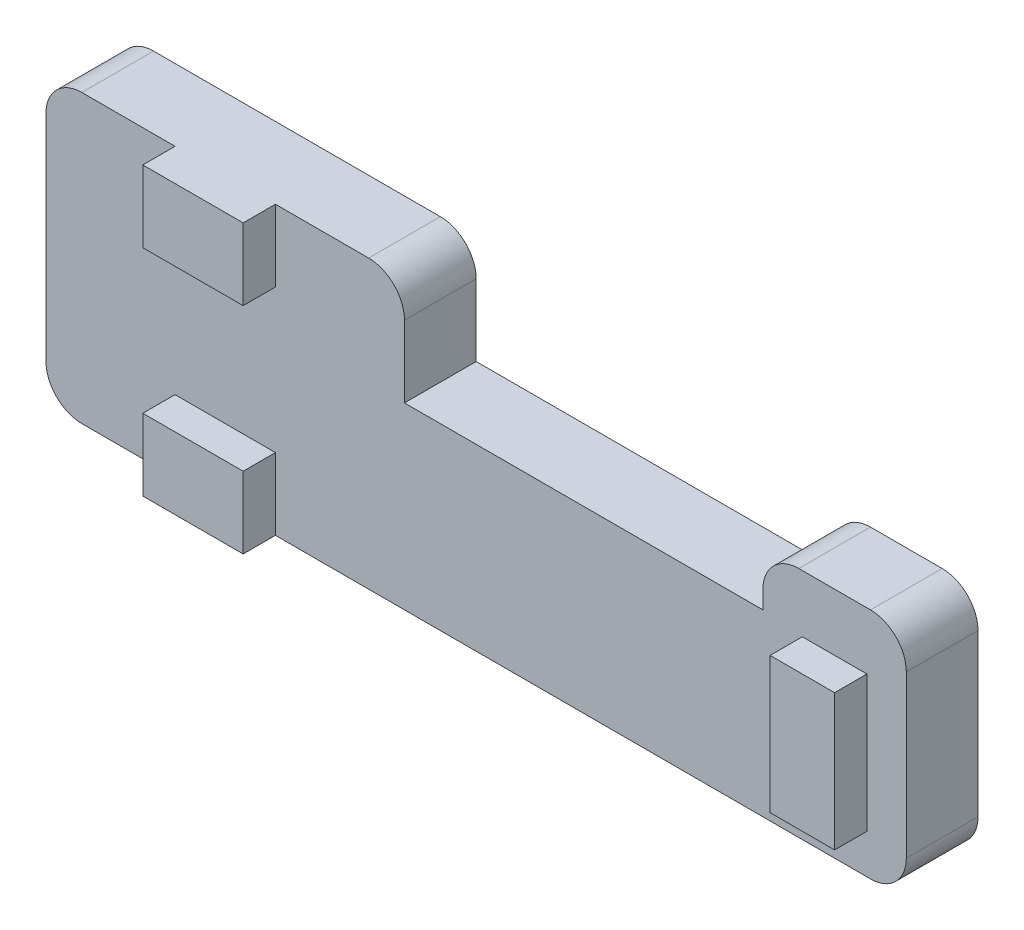
from build123d import *

# Parameters (mm, degrees)
SKETCH1_W           = 14
SKETCH1_H           = 22
SKETCH1_W_2         = 10
SKETCH1_H_2         = 18
EXTRUDE_THIN1_DEPTH = 2
SKETCH2_W           = 2
SKETCH2_H           = 22
BOSS_EXTRUDE1_DEPTH = 4.5
SKETCH3_W           = 22
SKETCH3_H           = 8
SKETCH3_W_2         = 18
SKETCH3_H_2         = 4
EXTRUDE_THIN2_DEPTH = 2
SKETCH4_W           = 20
SKETCH4_H           = 8
CUT_EXTRUDE1_DEPTH  = 26
SKETCH5_W           = 0.9
SKETCH5_H           = 1.9
SKETCH5_H_2         = 3.8
BOSS_EXTRUDE2_DEPTH = 0.9
SKETCH6_W           = 2
SKETCH6_H           = 1.9
BOSS_EXTRUDE3_DEPTH = 8
SKETCH7_W           = 2.8
SKETCH7_H           = 2
BOSS_EXTRUDE4_DEPTH = 0.9
SKETCH8_W           = 0.9
SKETCH8_H           = 0.9
CUT_EXTRUDE2_DEPTH  = 25.657656012
BOSS_EXTRUDE5_REACH = 26.658
SKETCH9_W           = 2
SKETCH9_H           = 3
BOSS_EXTRUDE6_DEPTH = 2
SKETCH11_W          = 1.1
SKETCH11_H          = 3.8
BOSS_EXTRUDE7_DEPTH = 0.9
SKETCH12_W          = 1.1
SKETCH12_H          = 3.8
CUT_EXTRUDE3_DEPTH  = 0.9
FILLET1_R           = 1


with BuildPart() as part:
    # Sketch1 → Extrude-Thin1 (new body)
    with BuildSketch(Plane(origin=(0, 0, 0), x_dir=(1, 0, 0), z_dir=(0, 1, 0))):
        with Locations((5, 9)):
            Rectangle(SKETCH1_W, SKETCH1_H)
        with Locations((5, 9)):
            Rectangle(SKETCH1_W_2, SKETCH1_H_2, mode=Mode.SUBTRACT)
    extrude(amount=EXTRUDE_THIN1_DEPTH)

    # Sketch2 → Boss-Extrude1 (add)
    with BuildSketch(Plane(origin=(0, 2, 0), x_dir=(1, 0, 0), z_dir=(0, 1, 0))):
        with Locations((11, 9)):
            Rectangle(SKETCH2_W, SKETCH2_H)
    extrude(amount=BOSS_EXTRUDE1_DEPTH)

    # Sketch3 → Extrude-Thin2 (add)
    with BuildSketch(Plane.ZY.offset(2)):
        with Locations((-9, 4)):
            Rectangle(SKETCH3_W, SKETCH3_H)
        with Locations((-9, 4)):
            Rectangle(SKETCH3_W_2, SKETCH3_H_2, mode=Mode.SUBTRACT)
    extrude(amount=-EXTRUDE_THIN2_DEPTH)

    # Sketch4 → Cut-Extrude1 (cut)
    with BuildSketch(Plane(origin=(12, 0, 0), x_dir=(0, 0, -1), z_dir=(1, 0, 0))):
        with Locations((8, 4)):
            Rectangle(SKETCH4_W, SKETCH4_H)
    extrude(amount=-CUT_EXTRUDE1_DEPTH, mode=Mode.SUBTRACT)

    # Sketch5 → Boss-Extrude2 (add)
    with BuildSketch(Plane.XY.offset(-18)):
        with Locations((-1.55, 7.05)):
            Rectangle(SKETCH5_W, SKETCH5_H)
        with Locations((-1.55, 0.95)):
            Rectangle(SKETCH5_W, SKETCH5_H)
        with Locations((11.55, 3)):
            Rectangle(SKETCH5_W, SKETCH5_H_2)
    extrude(amount=BOSS_EXTRUDE2_DEPTH)

    # Sketch6 → Boss-Extrude3 (add)
    with BuildSketch(Plane.ZY.offset(2)):
        Polygon((-18, 1.9), (-18, 6.1), (-18, 8), (-20, 8), (-20, 1.9), align=None)
        with Locations((-19, 0.95)):
            Rectangle(SKETCH6_W, SKETCH6_H)
    extrude(amount=BOSS_EXTRUDE3_DEPTH)

    # Sketch7 → Boss-Extrude4 (add)
    with BuildSketch(Plane.XY.offset(-18)):
        with Locations((-5, 7)):
            Rectangle(SKETCH7_W, SKETCH7_H)
        with Locations((-5, 1)):
            Rectangle(SKETCH7_W, SKETCH7_H)
    extrude(amount=BOSS_EXTRUDE4_DEPTH)

    # Sketch8 → Cut-Extrude2 (cut, through all)
    with BuildSketch(Plane(origin=(0, 8, 0), x_dir=(1, 0, 0), z_dir=(0, 1, 0))):
        with Locations((-1.55, 17.55)):
            Rectangle(SKETCH8_W, SKETCH8_H)
    extrude(amount=-CUT_EXTRUDE2_DEPTH, mode=Mode.SUBTRACT)

    # Sketch9 → Boss-Extrude5 (add, up to next)
    with BuildSketch(Plane(origin=(0, 0, 0), x_dir=(0, 0, -1), z_dir=(1, 0, 0)), mode=Mode.PRIVATE) as boss_extrude5_sk1:
        with Locations((19, 3.5)):
            Rectangle(SKETCH9_W, SKETCH9_H)
    boss_extrude5_tool1 = extrude(boss_extrude5_sk1.sketch, amount=BOSS_EXTRUDE5_REACH, mode=Mode.PRIVATE) - part.part
    add(boss_extrude5_tool1.solids().sort_by_distance((0, 3.5, -19))[0])

    # Sketch10 → Boss-Extrude6 (add)
    with BuildSketch(Plane(origin=(12, 0, 0), x_dir=(0, 0, -1), z_dir=(1, 0, 0))):
        Polygon((18, 6.5), (18, 4.9), (17.1, 4.9), (17.1, 1.1), (18, 1.1), (18, 0), (20, 0), (20, 6.5), align=None)
    extrude(amount=BOSS_EXTRUDE6_DEPTH)

    # Sketch11 → Boss-Extrude7 (add)
    with BuildSketch(Plane.XY.offset(-18)):
        with Locations((10.55, 3)):
            Rectangle(SKETCH11_W, SKETCH11_H)
    extrude(amount=BOSS_EXTRUDE7_DEPTH)

    # Sketch12 → Cut-Extrude3 (cut)
    with BuildSketch(Plane.XY.offset(-17.1)):
        with Locations((10.55, 3)):
            Rectangle(SKETCH12_W, SKETCH12_H)
        with Locations((13.45, 3)):
            Rectangle(SKETCH12_W, SKETCH12_H)
    extrude(amount=-CUT_EXTRUDE3_DEPTH, mode=Mode.SUBTRACT)

    # Fillet1
    fillet1_edges = [part.edges().sort_by_distance(p)[0] for p in [
        (-10, 0, -19),
        (-10, 8, -19),
        (14, 6.5, -19),
        (14, 0, -19),
        (10, 6.5, -19),
        (0, 8, -19),
    ]]
    fillet(fillet1_edges, radius=FILLET1_R)


solid = part.part
